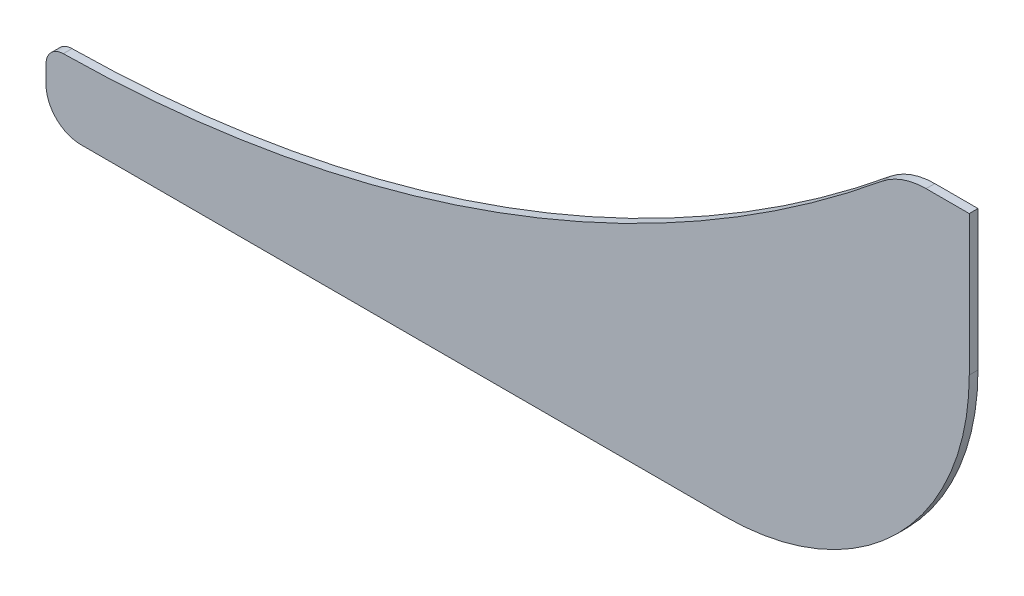
from build123d import *

# Parameters (mm, degrees)
BOSS_EXTRUDE1_DEPTH = 6.35
FILLET1_R           = 12.7


with BuildPart() as part:
    # Sketch1 → Boss-Extrude1 (new body)
    with BuildSketch(Plane.XY):
        with BuildLine():
            Line((-107.95, -236.22), (-107.95, -261.62))
            ThreePointArc((-107.95, -261.62), (-100.510512242, -279.580512242), (-82.55, -287.02))
            Line((-82.55, -287.02), (385.048811446, -287.02))
            ThreePointArc((385.048811446, -287.02), (510.772397141, -234.943585695), (562.848811446, -109.22))
            Line((562.848811446, -109.22), (562.848811446, -7.62))
            Line((562.848811446, -7.62), (531.483489065, -7.62))
            ThreePointArc((531.483489065, -7.62), (514.382281911, -10.584984437), (499.27732724, -19.133830162))
            ThreePointArc((499.27732724, -19.133830162), (214.482718595, -180.317046242), (-107.95, -236.22))
        make_face()
    extrude(amount=BOSS_EXTRUDE1_DEPTH)

    # Fillet1
    fillet1_edges = [part.edges().sort_by_distance(p)[0] for p in [
        (-107.95, -236.22, 3.175),
    ]]
    fillet(fillet1_edges, radius=FILLET1_R)


solid = part.part
